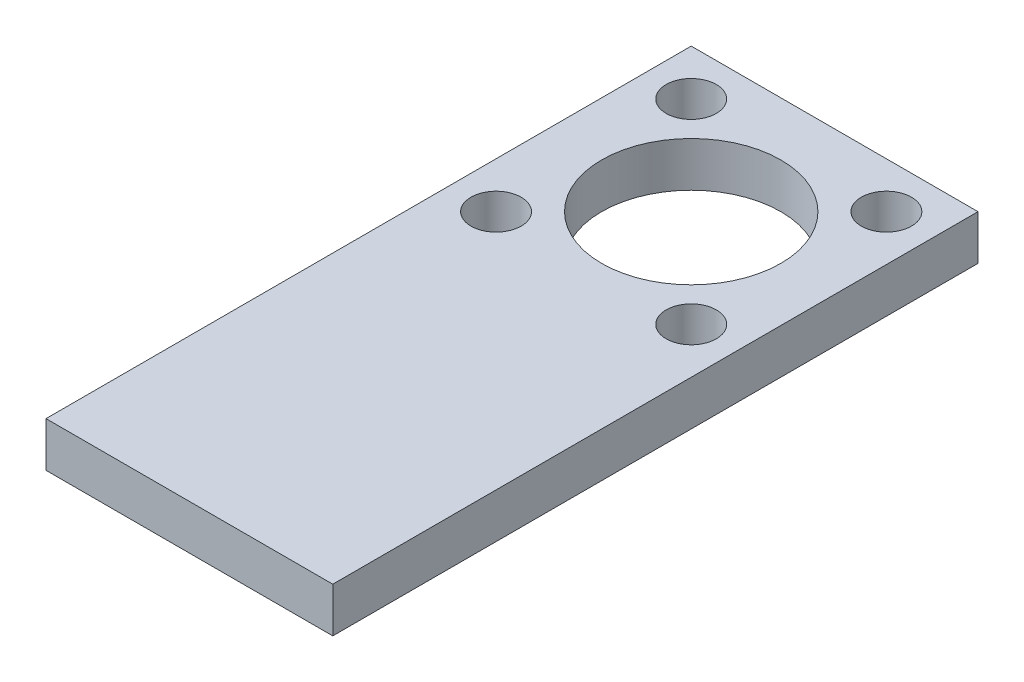
from build123d import *

# Parameters (mm, degrees)
SKETCH2_W           = 20.32
SKETCH2_H           = 45.72
BOSS_EXTRUDE4_DEPTH = 3.175
SKETCH7_R           = 1.778
SKETCH7_R_2         = 6.35
CUT_EXTRUDE1_DEPTH  = 3.175


with BuildPart() as part:
    # Sketch2 → Boss-Extrude4 (new body)
    with BuildSketch(Plane(origin=(0, 0, 0), x_dir=(1, 0, 0), z_dir=(0, 1, 0))):
        with Locations((-10.16, -22.86)):
            Rectangle(SKETCH2_W, SKETCH2_H)
    extrude(amount=BOSS_EXTRUDE4_DEPTH)

    # Sketch7 → Cut-Extrude1 (cut)
    with BuildSketch(Plane(origin=(0, 3.175, 0), x_dir=(1, 0, 0), z_dir=(0, 1, 0))):
        with Locations(Location((-17.074797213, -17.074797213, 0), (0, 0, 270))):
            Circle(SKETCH7_R)
        with Locations(Location((-3.245202787, -17.074797213, 0), (0, 0, 270))):
            Circle(SKETCH7_R)
        with Locations(Location((-17.074797213, -3.245202787, 0), (0, 0, 270))):
            Circle(SKETCH7_R)
        with Locations(Location((-3.245202787, -3.245202787, 0), (0, 0, 270))):
            Circle(SKETCH7_R)
        with Locations(Location((-10.16, -10.16, 0), (0, 0, 270))):
            Circle(SKETCH7_R_2)
    extrude(amount=-CUT_EXTRUDE1_DEPTH, mode=Mode.SUBTRACT)


solid = part.part
